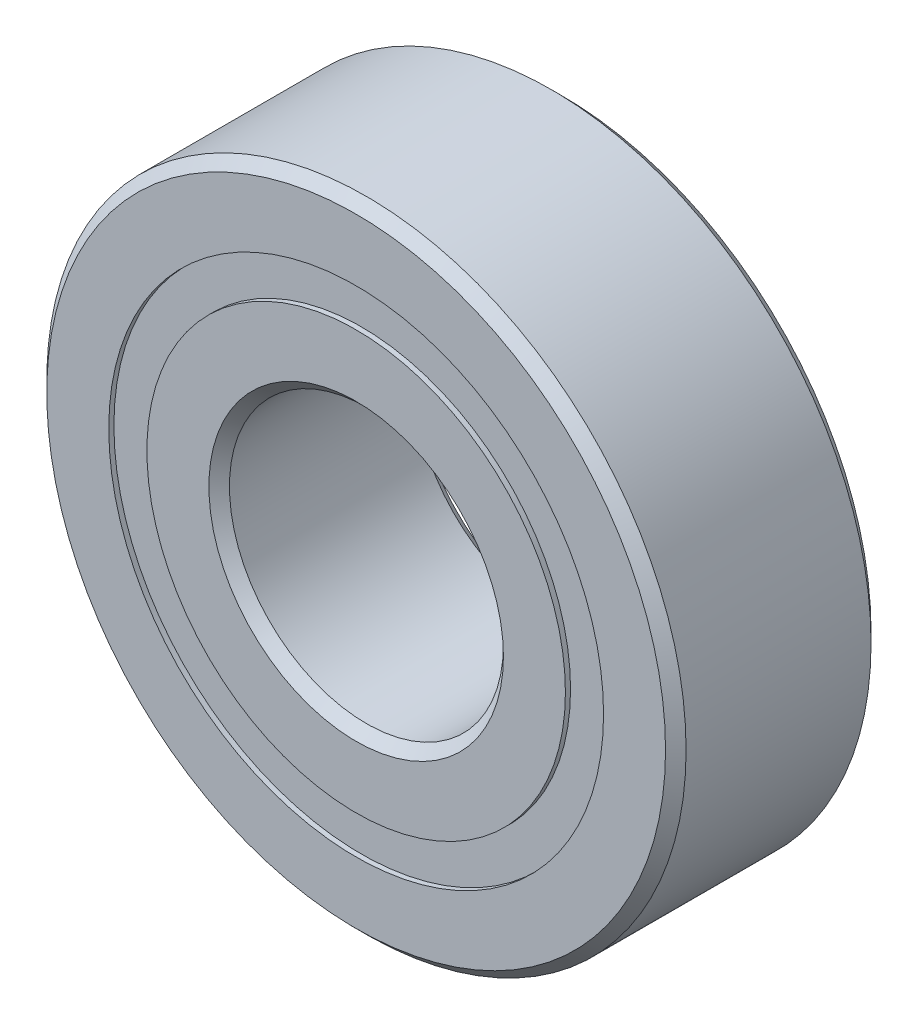
from build123d import *

# Parameters (mm, degrees)
CIRPATTERN1_COUNT = 10
SKETCH5_W         = 1.672929924
SKETCH5_H         = 1.325824176


with BuildPart() as part:
    # Sketch1 → Revolve1 (revolve)
    with BuildSketch(Plane(origin=(0, 0, 0), x_dir=(0, 0, -1), z_dir=(1, 0, 0)), mode=Mode.PRIVATE) as revolve1_sk:
        with BuildLine():
            Line((3.2146875, 11.1125), (-3.2146875, 11.1125))
            Line((-3.2146875, 11.1125), (-3.571875, 10.7553125))
            Line((-3.571875, 10.7553125), (-3.571875, 8.600412088))
            Line((-3.571875, 8.600412088), (-1.5875, 8.600412088))
            ThreePointArc((-1.5875, 8.600412088), (0, 9.657851326), (1.5875, 8.600412088))
            Line((1.5875, 8.600412088), (3.571875, 8.600412088))
            Line((3.571875, 8.600412088), (3.571875, 10.7553125))
            Line((3.571875, 10.7553125), (3.2146875, 11.1125))
        make_face()
    revolve(revolve1_sk.sketch.rotate(Axis((0, 0, 3.571875), (0, 0, -1)), 90), axis=Axis((0, 0, 3.571875), (0, 0, -1)))


with BuildPart() as body_2:
    # Sketch3 → Revolve3 (revolve)
    with BuildSketch(Plane(origin=(0, 0, 0), x_dir=(0, 0, -1), z_dir=(1, 0, 0)), mode=Mode.PRIVATE) as revolve3_sk:
        with BuildLine():
            Line((-3.571875, 7.274587912), (-1.5875, 7.274587912))
            ThreePointArc((-1.5875, 7.274587912), (0, 6.217148674), (1.5875, 7.274587912))
            Line((1.5875, 7.274587912), (3.571875, 7.274587912))
            Line((3.571875, 7.274587912), (3.571875, 5.1196875))
            Line((3.571875, 5.1196875), (3.2146875, 4.7625))
            Line((3.2146875, 4.7625), (-3.2146875, 4.7625))
            Line((-3.2146875, 4.7625), (-3.571875, 5.1196875))
            Line((-3.571875, 5.1196875), (-3.571875, 7.274587912))
        make_face()
    revolve(revolve3_sk.sketch.rotate(Axis((0, 0, 3.571875), (0, 0, -1)), 90), axis=Axis((0, 0, 3.571875), (0, 0, -1)))


with BuildPart() as body_3:
    # Sketch4 → Revolve4 (revolve)
    with BuildSketch(Plane(origin=(0, 0, 0), x_dir=(0, 0, -1), z_dir=(1, 0, 0))):
        with BuildLine():
            Line((-1.720351326, 7.9375), (1.720351326, 7.9375))
            ThreePointArc((1.720351326, 7.9375), (0, 9.657851326), (-1.720351326, 7.9375))
        make_face()
    revolve(axis=Axis((0, 7.9375, 1.720351326), (0, 0, -1)))


with BuildPart() as cirpattern1_1:
    # CirPattern1: pattern copy
    add(body_3.part.rotate(Axis((0, 0, 0), (0, 0, 1)), 1 * 360 / CIRPATTERN1_COUNT))


with BuildPart() as cirpattern1_2:
    # CirPattern1: pattern copy
    add(body_3.part.rotate(Axis((0, 0, 0), (0, 0, 1)), 2 * 360 / CIRPATTERN1_COUNT))


with BuildPart() as cirpattern1_3:
    # CirPattern1: pattern copy
    add(body_3.part.rotate(Axis((0, 0, 0), (0, 0, 1)), 3 * 360 / CIRPATTERN1_COUNT))


with BuildPart() as cirpattern1_4:
    # CirPattern1: pattern copy
    add(body_3.part.rotate(Axis((0, 0, 0), (0, 0, 1)), 4 * 360 / CIRPATTERN1_COUNT))


with BuildPart() as cirpattern1_5:
    # CirPattern1: pattern copy
    add(body_3.part.rotate(Axis((0, 0, 0), (0, 0, 1)), 5 * 360 / CIRPATTERN1_COUNT))


with BuildPart() as cirpattern1_6:
    # CirPattern1: pattern copy
    add(body_3.part.rotate(Axis((0, 0, 0), (0, 0, 1)), 6 * 360 / CIRPATTERN1_COUNT))


with BuildPart() as cirpattern1_7:
    # CirPattern1: pattern copy
    add(body_3.part.rotate(Axis((0, 0, 0), (0, 0, 1)), 7 * 360 / CIRPATTERN1_COUNT))


with BuildPart() as cirpattern1_8:
    # CirPattern1: pattern copy
    add(body_3.part.rotate(Axis((0, 0, 0), (0, 0, 1)), 8 * 360 / CIRPATTERN1_COUNT))


with BuildPart() as cirpattern1_9:
    # CirPattern1: pattern copy
    add(body_3.part.rotate(Axis((0, 0, 0), (0, 0, 1)), 9 * 360 / CIRPATTERN1_COUNT))


with BuildPart() as body_13:
    # Sketch5 → Revolve5 (revolve)
    with BuildSketch(Plane(origin=(0, 0, 0), x_dir=(0, 0, -1), z_dir=(1, 0, 0)), mode=Mode.PRIVATE) as revolve5_sk:
        with Locations((-2.556816288, 7.9375)):
            Rectangle(SKETCH5_W, SKETCH5_H)
        with Locations((2.556816288, 7.9375)):
            Rectangle(SKETCH5_W, SKETCH5_H)
    revolve(revolve5_sk.sketch.rotate(Axis((0, 0, 3.571875), (0, 0, -1)), 90), axis=Axis((0, 0, 3.571875), (0, 0, -1)))


solid = Compound([part.part, body_2.part, body_3.part, cirpattern1_1.part, cirpattern1_2.part, cirpattern1_3.part, cirpattern1_4.part, cirpattern1_5.part, cirpattern1_6.part, cirpattern1_7.part, cirpattern1_8.part, cirpattern1_9.part, body_13.part])
